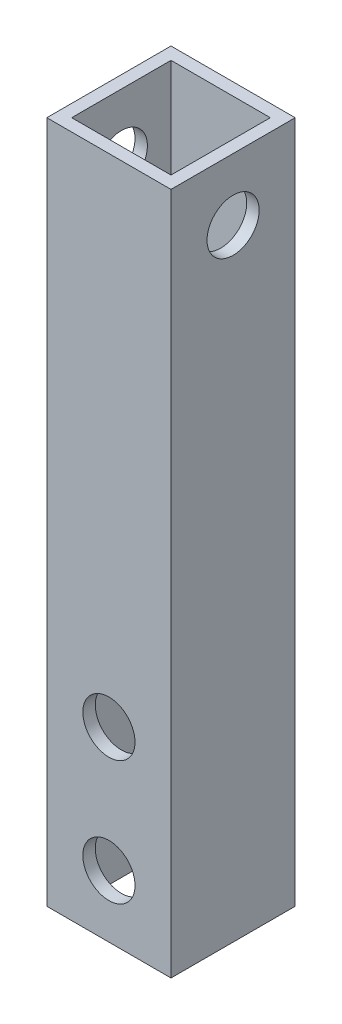
from build123d import *

# Parameters (mm, degrees)
SKETCH_1_W          = 10
SKETCH_1_H          = 10
SKETCH_1_W_2        = 8
SKETCH_1_H_2        = 8
EXTRUDE_1_DEPTH     = 55
SKETCH_2_R          = 2.1
CUT_EXTRUDE_1_DEPTH = 57.124860802
SKETCH_3_R          = 2.1
CUT_EXTRUDE_2_DEPTH = 57.124860802


with BuildPart() as part:
    # ｽｹｯﾁ1 → 押し出し-薄板1 (new body)
    with BuildSketch(Plane(origin=(0, 0, 0), x_dir=(1, 0, 0), z_dir=(0, 1, 0))):
        Rectangle(SKETCH_1_W, SKETCH_1_H)
        Rectangle(SKETCH_1_W_2, SKETCH_1_H_2, mode=Mode.SUBTRACT)
    extrude(amount=EXTRUDE_1_DEPTH)

    # ｽｹｯﾁ2 → ｶｯﾄ - 押し出し1 (cut, through all)
    with BuildSketch(Plane.XY.offset(5)):
        with Locations((0, 15)):
            Circle(SKETCH_2_R)
        with Locations((0, 5)):
            Circle(SKETCH_2_R)
    extrude(amount=-CUT_EXTRUDE_1_DEPTH, mode=Mode.SUBTRACT)

    # ｽｹｯﾁ3 → ｶｯﾄ - 押し出し2 (cut, through all)
    with BuildSketch(Plane(origin=(5, 0, 0), x_dir=(0, 0, -1), z_dir=(1, 0, 0))):
        with Locations((0, 50)):
            Circle(SKETCH_3_R)
    extrude(amount=-CUT_EXTRUDE_2_DEPTH, mode=Mode.SUBTRACT)


solid = part.part
